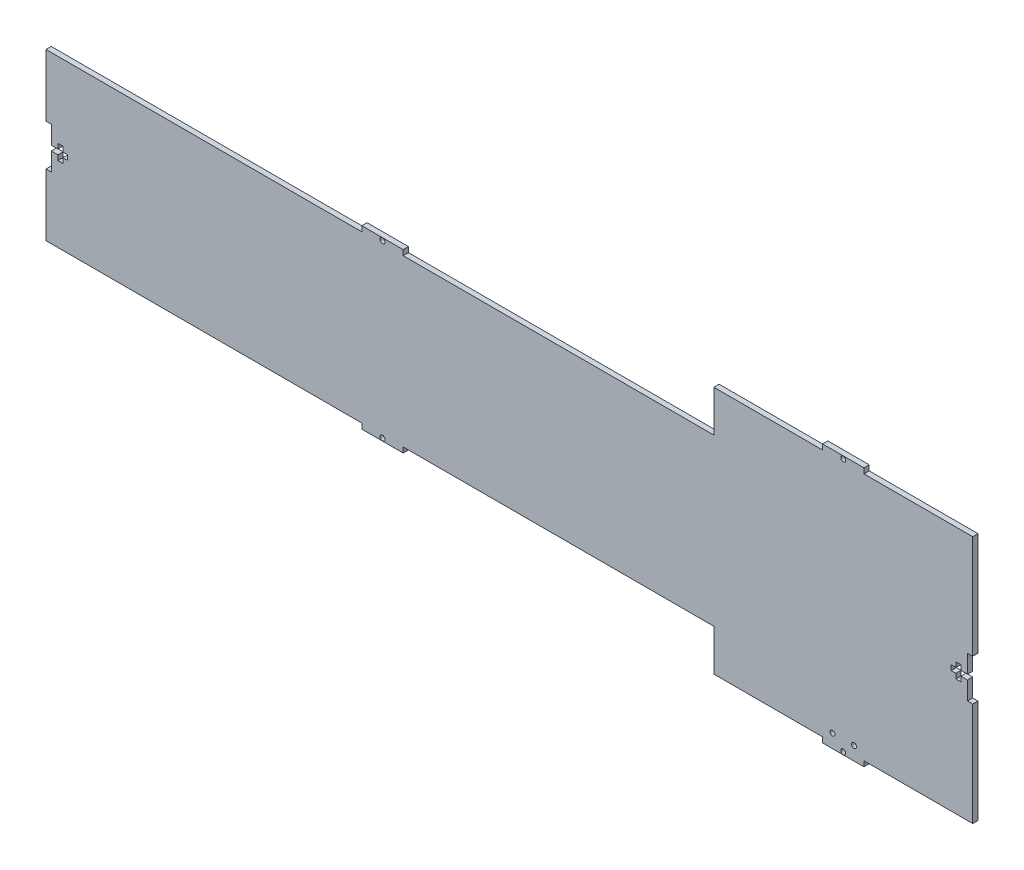
from build123d import *

# Parameters (mm, degrees)
SKETCH1_R           = 1.5
BOSS_EXTRUDE1_DEPTH = 3.18
SKETCH2_R           = 1.5
CUT_EXTRUDE1_DEPTH  = 10


with BuildPart() as part:
    # Sketch1 → Boss-Extrude1 (new body)
    with BuildSketch(Plane.XY):
        Polygon((-203.18, 50), (-203.18, 12.5), (-200, 12.5), (-200, 1.5), (-196, 1.5), (-196, 4.5), (-193, 4.5), (-193, 1.5), (-190.18, 1.5), (-190.18, -1.5), (-193, -1.5), (-193, -4.5), (-196, -4.5), (-196, -1.5), (-200, -1.5), (-200, -12.5), (-203.18, -12.5), (-203.18, -50), (-12.5, -50), (-12.5, -53.18), (12.5, -53.18), (12.5, -50), (200, -50), (200, -75), (265.68, -75), (265.68, -78.18), (290.68, -78.18), (290.68, -75), (356.36, -75), (356.36, -12.5), (353.18, -12.5), (353.18, -1.5), (349.18, -1.5), (349.18, -4.5), (346.18, -4.5), (346.18, -1.5), (343.36, -1.5), (343.36, 1.5), (346.18, 1.5), (346.18, 4.5), (349.18, 4.5), (349.18, 1.5), (353.18, 1.5), (353.18, 12.5), (356.36, 12.5), (356.36, 75), (290.68, 75), (290.68, 78.18), (265.68, 78.18), (265.68, 75), (200, 75), (200, 50), (12.5, 50), (12.5, 53.18), (-12.5, 53.18), (-12.5, 50), align=None)
        with Locations(Location((0, -51.59, 0), (0, 0, 180))):
            Circle(SKETCH1_R, mode=Mode.SUBTRACT)
        with Locations(Location((0, 51.59, 0), (0, 0, 180))):
            Circle(SKETCH1_R, mode=Mode.SUBTRACT)
        with Locations(Location((278.18, -76.59, 0), (0, 0, 180))):
            Circle(SKETCH1_R, mode=Mode.SUBTRACT)
        with Locations(Location((278.18, 76.59, 0), (0, 0, 180))):
            Circle(SKETCH1_R, mode=Mode.SUBTRACT)
    extrude(amount=BOSS_EXTRUDE1_DEPTH)

    # Sketch2 → Cut-Extrude1 (cut)
    with BuildSketch(Plane.XY.offset(3.18)):
        with Locations((284.68, -70)):
            Circle(SKETCH2_R)
        with Locations((271.68, -70)):
            Circle(SKETCH2_R)
    extrude(amount=-CUT_EXTRUDE1_DEPTH, mode=Mode.SUBTRACT)


solid = part.part
